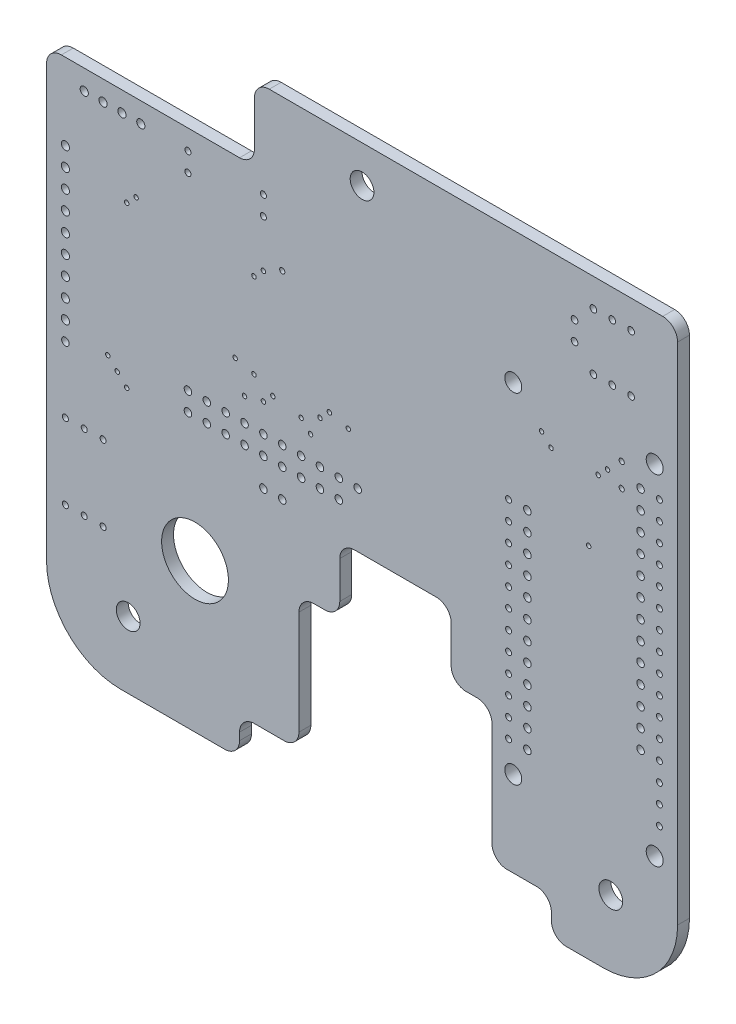
from build123d import *

# Parameters (mm, degrees)
SKETCH_20_R         = 1.6
SKETCH_20_R_2       = 1.143
SKETCH_20_R_3       = 4.5
BOSS_EXTRUDE1_DEPTH = 1.6
SKETCH_44_R         = 0.508
SKETCH_44_R_2       = 0.45
SKETCH_44_R_3       = 0.4064
SKETCH_44_R_4       = 0.4
SKETCH_44_R_5       = 0.55
SKETCH_44_R_6       = 0.35
SKETCH_44_R_7       = 0.3
CUT_EXTRUDE2_DEPTH  = 117.737140619


with BuildPart() as part:
    # Sketch 20 → Boss-Extrude1 (new body)
    with BuildSketch(Plane.XY):
        with BuildLine():
            Line((28, 72), (28, 78))
            ThreePointArc((28, 78), (28.585786438, 79.414213562), (30, 80))
            Line((30, 80), (83, 80))
            ThreePointArc((83, 80), (84.414213562, 79.414213562), (85, 78))
            Line((85, 78), (85, 10))
            ThreePointArc((85, 10), (82.071067812, 2.928932188), (75, 0))
            Line((75, 0), (70, 0))
            ThreePointArc((70, 0), (68.585786438, 0.585786438), (68, 2))
            Line((68, 2), (68, 3))
            ThreePointArc((68, 3), (67.414213562, 4.414213562), (66, 5))
            Line((66, 5), (62, 5))
            ThreePointArc((62, 5), (60.585786438, 5.585786438), (60, 7))
            Line((60, 7), (60, 21))
            ThreePointArc((60, 21), (59.414213562, 22.414213562), (58, 23))
            Line((58, 23), (56.5, 23))
            ThreePointArc((56.5, 23), (55.085786438, 23.585786438), (54.5, 25))
            Line((54.5, 25), (54.5, 30))
            ThreePointArc((54.5, 30), (53.914213562, 31.414213562), (52.5, 32))
            Line((52.5, 32), (41.5, 32))
            ThreePointArc((41.5, 32), (40.085786438, 31.414213562), (39.5, 30))
            Line((39.5, 30), (39.5, 25))
            ThreePointArc((39.5, 25), (38.914213562, 23.585786438), (37.5, 23))
            Line((37.5, 23), (36, 23))
            ThreePointArc((36, 23), (34.585786438, 22.414213562), (34, 21))
            Line((34, 21), (34, 7))
            ThreePointArc((34, 7), (33.414213562, 5.585786438), (32, 5))
            Line((32, 5), (28, 5))
            ThreePointArc((28, 5), (26.585786438, 4.414213562), (26, 3))
            Line((26, 3), (26, 2))
            ThreePointArc((26, 2), (25.414213562, 0.585786438), (24, 0))
            Line((24, 0), (10, 0))
            ThreePointArc((10, 0), (2.928932188, 2.928932188), (0, 10))
            Line((0, 10), (0, 68))
            ThreePointArc((0, 68), (0.585786438, 69.414213562), (2, 70))
            Line((2, 70), (26, 70))
            ThreePointArc((26, 70), (27.414213562, 70.585786438), (28, 72))
        make_face()
        with Locations((42.5, 75)):
            Circle(SKETCH_20_R, mode=Mode.SUBTRACT)
        with Locations((11, 9)):
            Circle(SKETCH_20_R, mode=Mode.SUBTRACT)
        with Locations((76, 9)):
            Circle(SKETCH_20_R, mode=Mode.SUBTRACT)
        with Locations((62.865, 62.23)):
            Circle(SKETCH_20_R_2, mode=Mode.SUBTRACT)
        with Locations((62.865, 16.51)):
            Circle(SKETCH_20_R_2, mode=Mode.SUBTRACT)
        with Locations((81.915, 16.51)):
            Circle(SKETCH_20_R_2, mode=Mode.SUBTRACT)
        with Locations((81.915, 62.23)):
            Circle(SKETCH_20_R_2, mode=Mode.SUBTRACT)
        with Locations((20, 20)):
            Circle(SKETCH_20_R_3, mode=Mode.SUBTRACT)
    extrude(amount=BOSS_EXTRUDE1_DEPTH)

    # Sketch 44 → Cut-Extrude2 (cut, through all)
    with BuildSketch(Plane.XY):
        with Locations((31.75, 33.02)):
            Circle(SKETCH_44_R)
        with Locations((29.21, 33.02)):
            Circle(SKETCH_44_R)
        with Locations((41.91, 39.37)):
            Circle(SKETCH_44_R)
        with Locations((2.54, 36.83)):
            Circle(SKETCH_44_R)
        with Locations((80.01, 58.42)):
            Circle(SKETCH_44_R)
        with Locations((80.01, 27.94)):
            Circle(SKETCH_44_R)
        with Locations((80.01, 30.48)):
            Circle(SKETCH_44_R)
        with Locations((80.01, 33.02)):
            Circle(SKETCH_44_R)
        with Locations((80.01, 35.56)):
            Circle(SKETCH_44_R)
        with Locations((80.01, 38.1)):
            Circle(SKETCH_44_R)
        with Locations((80.01, 40.64)):
            Circle(SKETCH_44_R)
        with Locations((80.01, 43.18)):
            Circle(SKETCH_44_R)
        with Locations((80.01, 45.72)):
            Circle(SKETCH_44_R)
        with Locations((80.01, 48.26)):
            Circle(SKETCH_44_R)
        with Locations((80.01, 50.8)):
            Circle(SKETCH_44_R)
        with Locations((80.01, 53.34)):
            Circle(SKETCH_44_R)
        with Locations((80.01, 55.88)):
            Circle(SKETCH_44_R)
        with Locations((64.77, 48.26)):
            Circle(SKETCH_44_R)
        with Locations((64.77, 45.72)):
            Circle(SKETCH_44_R)
        with Locations((64.77, 43.18)):
            Circle(SKETCH_44_R)
        with Locations((64.77, 40.64)):
            Circle(SKETCH_44_R)
        with Locations((64.77, 38.1)):
            Circle(SKETCH_44_R)
        with Locations((64.77, 35.56)):
            Circle(SKETCH_44_R)
        with Locations((64.77, 33.02)):
            Circle(SKETCH_44_R)
        with Locations((64.77, 30.48)):
            Circle(SKETCH_44_R)
        with Locations((64.77, 27.94)):
            Circle(SKETCH_44_R)
        with Locations((64.77, 25.4)):
            Circle(SKETCH_44_R)
        with Locations((64.77, 22.86)):
            Circle(SKETCH_44_R)
        with Locations((64.77, 20.32)):
            Circle(SKETCH_44_R)
        with Locations((19.05, 36.83)):
            Circle(SKETCH_44_R)
        with Locations((19.05, 39.37)):
            Circle(SKETCH_44_R)
        with Locations((21.59, 36.83)):
            Circle(SKETCH_44_R)
        with Locations((21.59, 39.37)):
            Circle(SKETCH_44_R)
        with Locations((24.13, 36.83)):
            Circle(SKETCH_44_R)
        with Locations((24.13, 39.37)):
            Circle(SKETCH_44_R)
        with Locations((26.67, 36.83)):
            Circle(SKETCH_44_R)
        with Locations((26.67, 39.37)):
            Circle(SKETCH_44_R)
        with Locations((29.21, 36.83)):
            Circle(SKETCH_44_R)
        with Locations((29.21, 39.37)):
            Circle(SKETCH_44_R)
        with Locations((78.74, 76.2)):
            Circle(SKETCH_44_R_2)
        with Locations((71.12, 71.12)):
            Circle(SKETCH_44_R_2)
        with Locations((71.12, 73.66)):
            Circle(SKETCH_44_R_2)
        with Locations((76.2, 76.2)):
            Circle(SKETCH_44_R_2)
        with Locations((78.74, 68.58)):
            Circle(SKETCH_44_R_2)
        with Locations((76.2, 68.58)):
            Circle(SKETCH_44_R_2)
        with Locations((73.66, 68.58)):
            Circle(SKETCH_44_R_2)
        with Locations((73.66, 76.2)):
            Circle(SKETCH_44_R_2)
        with Locations((31.75, 36.83)):
            Circle(SKETCH_44_R)
        with Locations((31.75, 39.37)):
            Circle(SKETCH_44_R)
        with Locations((34.29, 36.83)):
            Circle(SKETCH_44_R)
        with Locations((34.29, 39.37)):
            Circle(SKETCH_44_R)
        with Locations((36.83, 36.83)):
            Circle(SKETCH_44_R)
        with Locations((36.83, 39.37)):
            Circle(SKETCH_44_R)
        with Locations((39.37, 36.83)):
            Circle(SKETCH_44_R)
        with Locations((39.37, 39.37)):
            Circle(SKETCH_44_R)
        with Locations((2.54, 27.94)):
            Circle(SKETCH_44_R_3)
        with Locations((2.54, 17.78)):
            Circle(SKETCH_44_R_3)
        with Locations((5.08, 27.94)):
            Circle(SKETCH_44_R_3)
        with Locations((5.08, 17.78)):
            Circle(SKETCH_44_R_3)
        with Locations((7.62, 27.94)):
            Circle(SKETCH_44_R_3)
        with Locations((7.62, 17.78)):
            Circle(SKETCH_44_R_3)
        with Locations((29.21, 64.77)):
            Circle(SKETCH_44_R_3)
        with Locations((19.05, 64.77)):
            Circle(SKETCH_44_R_3)
        with Locations((29.21, 67.31)):
            Circle(SKETCH_44_R_3)
        with Locations((19.05, 67.31)):
            Circle(SKETCH_44_R_3)
        with Locations((82.55, 55.88)):
            Circle(SKETCH_44_R_4)
        with Locations((82.55, 48.26)):
            Circle(SKETCH_44_R_4)
        with Locations((62.23, 48.26)):
            Circle(SKETCH_44_R_4)
        with Locations((82.55, 20.32)):
            Circle(SKETCH_44_R_4)
        with Locations((62.23, 45.72)):
            Circle(SKETCH_44_R_4)
        with Locations((82.55, 50.8)):
            Circle(SKETCH_44_R_4)
        with Locations((62.23, 30.48)):
            Circle(SKETCH_44_R_4)
        with Locations((62.23, 25.4)):
            Circle(SKETCH_44_R_4)
        with Locations((62.23, 20.32)):
            Circle(SKETCH_44_R_4)
        with Locations((62.23, 22.86)):
            Circle(SKETCH_44_R_4)
        with Locations((62.23, 38.1)):
            Circle(SKETCH_44_R_4)
        with Locations((62.23, 35.56)):
            Circle(SKETCH_44_R_4)
        with Locations((62.23, 40.64)):
            Circle(SKETCH_44_R_4)
        with Locations((62.23, 33.02)):
            Circle(SKETCH_44_R_4)
        with Locations((62.23, 27.94)):
            Circle(SKETCH_44_R_4)
        with Locations((82.55, 27.94)):
            Circle(SKETCH_44_R_4)
        with Locations((82.55, 30.48)):
            Circle(SKETCH_44_R_4)
        with Locations((82.55, 53.34)):
            Circle(SKETCH_44_R_4)
        with Locations((82.55, 45.72)):
            Circle(SKETCH_44_R_4)
        with Locations((82.55, 43.18)):
            Circle(SKETCH_44_R_4)
        with Locations((82.55, 40.64)):
            Circle(SKETCH_44_R_4)
        with Locations((82.55, 38.1)):
            Circle(SKETCH_44_R_4)
        with Locations((82.55, 35.56)):
            Circle(SKETCH_44_R_4)
        with Locations((82.55, 58.42)):
            Circle(SKETCH_44_R_4)
        with Locations((82.55, 25.4)):
            Circle(SKETCH_44_R_4)
        with Locations((82.55, 33.02)):
            Circle(SKETCH_44_R_4)
        with Locations((82.55, 22.86)):
            Circle(SKETCH_44_R_4)
        with Locations((62.23, 43.18)):
            Circle(SKETCH_44_R_4)
        with Locations((7.62, 67.31)):
            Circle(SKETCH_44_R_5)
        with Locations((2.54, 39.37)):
            Circle(SKETCH_44_R_5)
        with Locations((2.54, 59.69)):
            Circle(SKETCH_44_R_5)
        with Locations((2.54, 57.15)):
            Circle(SKETCH_44_R_5)
        with Locations((2.54, 54.61)):
            Circle(SKETCH_44_R_5)
        with Locations((2.54, 52.07)):
            Circle(SKETCH_44_R_5)
        with Locations((2.54, 49.53)):
            Circle(SKETCH_44_R_5)
        with Locations((2.54, 46.99)):
            Circle(SKETCH_44_R_5)
        with Locations((2.54, 44.45)):
            Circle(SKETCH_44_R_5)
        with Locations((2.54, 41.91)):
            Circle(SKETCH_44_R_5)
        with Locations((12.7, 67.31)):
            Circle(SKETCH_44_R_5)
        with Locations((10.16, 67.31)):
            Circle(SKETCH_44_R_5)
        with Locations((5.08, 67.31)):
            Circle(SKETCH_44_R_5)
        with Locations((77.47, 60.325)):
            Circle(SKETCH_44_R_6)
        with Locations((77.47, 57.15)):
            Circle(SKETCH_44_R_6)
        with Locations((31.75, 59.69)):
            Circle(SKETCH_44_R_6)
        with Locations((73.025, 48.26)):
            Circle(SKETCH_44_R_7)
        with Locations((8.255, 38.1)):
            Circle(SKETCH_44_R_7)
        with Locations((26.67, 42.545)):
            Circle(SKETCH_44_R_7)
        with Locations((29.21, 43.18)):
            Circle(SKETCH_44_R_7)
        with Locations((30.48, 44.45)):
            Circle(SKETCH_44_R_7)
        with Locations((27.94, 45.72)):
            Circle(SKETCH_44_R_7)
        with Locations((25.4, 46.355)):
            Circle(SKETCH_44_R_7)
        with Locations((35.56, 42.545)):
            Circle(SKETCH_44_R_7)
        with Locations((34.29, 43.815)):
            Circle(SKETCH_44_R_7)
        with Locations((9.525, 36.83)):
            Circle(SKETCH_44_R_7)
        with Locations((40.64, 45.72)):
            Circle(SKETCH_44_R_7)
        with Locations((36.83, 45.085)):
            Circle(SKETCH_44_R_7)
        with Locations((10.795, 35.56)):
            Circle(SKETCH_44_R_7)
        with Locations((38.1, 46.355)):
            Circle(SKETCH_44_R_7)
        with Locations((75.565, 58.42)):
            Circle(SKETCH_44_R_7)
        with Locations((29.21, 58.42)):
            Circle(SKETCH_44_R_7)
        with Locations((12.065, 58.42)):
            Circle(SKETCH_44_R_7)
        with Locations((66.675, 58.42)):
            Circle(SKETCH_44_R_7)
        with Locations((74.295, 57.15)):
            Circle(SKETCH_44_R_7)
        with Locations((27.94, 57.15)):
            Circle(SKETCH_44_R_7)
        with Locations((10.795, 57.15)):
            Circle(SKETCH_44_R_7)
        with Locations((67.945, 57.15)):
            Circle(SKETCH_44_R_7)
    extrude(amount=CUT_EXTRUDE2_DEPTH, mode=Mode.SUBTRACT)


solid = part.part
